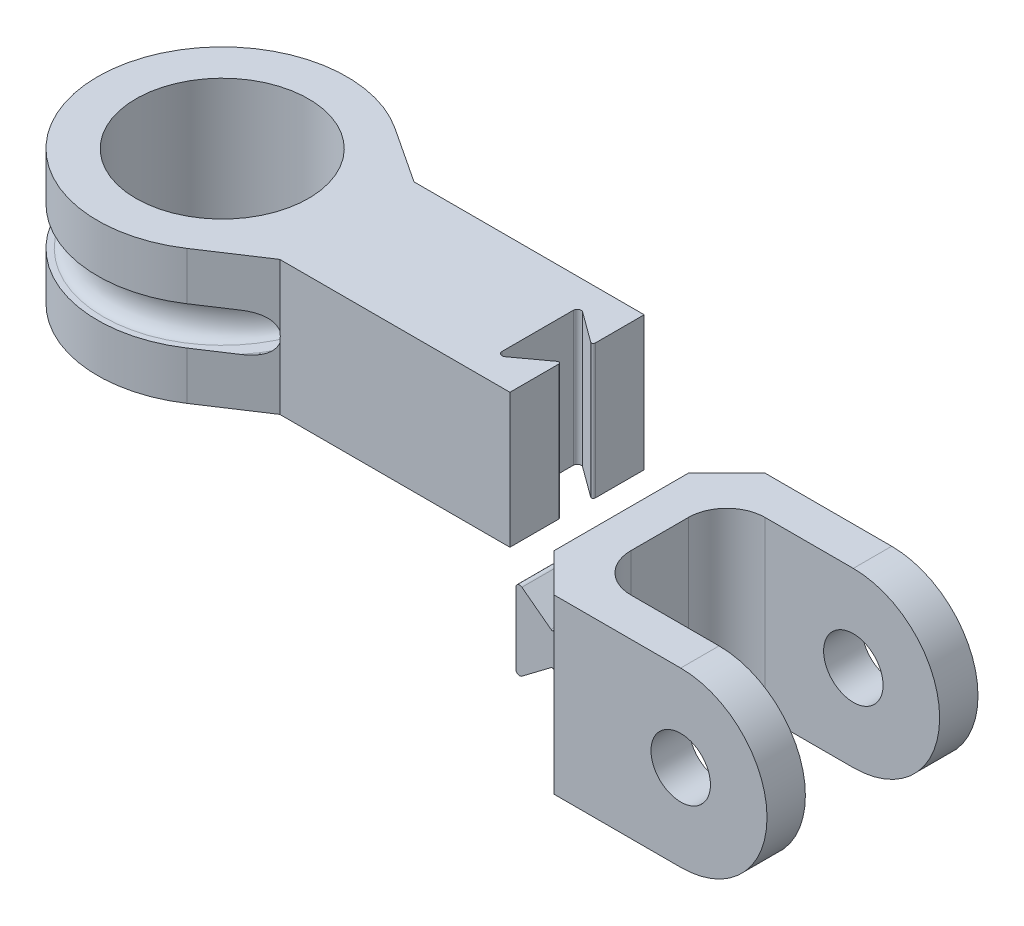
from build123d import *

# Parameters (mm, degrees)
SKETCH2_R            = 4.5
BOSS_EXTRUDE3_DEPTH  = 7
BOSS_EXTRUDE4_DEPTH  = 7
BOSS_EXTRUDE10_DEPTH = 2
CUT_EXTRUDE6_DEPTH   = 29.118300343
FILLET4_R            = 2
SKETCH18_R           = 1.55
CUT_EXTRUDE7_DEPTH   = 2
FILLET6_R            = 2


with BuildPart() as part:
    # Sketch2 → Boss-Extrude3 (new body)
    with BuildSketch(Plane(origin=(0, 0, 0), x_dir=(1, 0, 0), z_dir=(0, 1, 0))):
        with BuildLine():
            Line((6.168188074, -3.5), (6.168188074, -0.952081813))
            ThreePointArc((6.168188074, -0.952081813), (6.113436832, -0.862904742), (6.009137075, -0.87137878))
            Line((6.009137075, -0.87137878), (4.436290073, -2.02224244))
            ThreePointArc((4.436290073, -2.02224244), (4.22769056, -2.039190516), (4.118188074, -1.860836375))
            Line((4.118188074, -1.860836375), (4.118188074, 1.860836375))
            ThreePointArc((4.118188074, 1.860836375), (4.22769056, 2.039190516), (4.436290073, 2.02224244))
            Line((4.436290073, 2.02224244), (6.009137075, 0.87137878))
            ThreePointArc((6.009137075, 0.87137878), (6.113436832, 0.862904742), (6.168188074, 0.952081813))
            Line((6.168188074, 0.952081813), (6.168188074, 3.5))
            Line((6.168188074, 3.5), (-5.831811926, 3.5))
            Line((-5.831811926, 3.5), (-8.753830274, 5.426605505))
            ThreePointArc((-8.753830274, 5.426605505), (-18.831811926, 0), (-8.753830274, -5.426605505))
            Line((-8.753830274, -5.426605505), (-5.831811926, -3.5))
            Line((-5.831811926, -3.5), (6.168188074, -3.5))
        make_face()
        with Locations(Location((-12.331811926, 0, 0), (0, 0, 270))):
            Circle(SKETCH2_R, mode=Mode.SUBTRACT)
    extrude(amount=BOSS_EXTRUDE3_DEPTH)

    # Sketch19 → Cut-Revolve1 (revolve, cut)
    with BuildSketch(Plane(origin=(-12.33, -4.465182267, -12.793633871), x_dir=(0, 1, 0), z_dir=(1, 0, 0))):
        with BuildLine():
            Line((6.965182267, 6.598633871), (6.965182267, 5.988633871))
            add(Edge.make_bspline(
                [(6.965182267, 5.988633871), (6.965182267, 5.388633871), (7.965182267, 5.388633871), (8.965182267, 5.388633871), (8.965182267, 5.988633871)],
                knots=[3.141592654, 3.141592654, 3.141592654, 4.71238898, 4.71238898, 6.283185307, 6.283185307, 6.283185307], degree=2, weights=[1, 0.707106781, 1, 0.707106781, 1]))
            Line((8.965182267, 5.988633871), (8.965182267, 6.598633871))
            add(Edge.make_bspline(
                [(8.965182267, 6.598633871), (8.965182267, 7.198633871), (7.965182267, 7.198633871), (6.965182267, 7.198633871), (6.965182267, 6.598633871)],
                knots=[3.141592654, 3.141592654, 3.141592654, 4.71238898, 4.71238898, 6.283185307, 6.283185307, 6.283185307], degree=2, weights=[1, 0.707106781, 1, 0.707106781, 1]))
        make_face()
    revolve(axis=Axis((-12.33, 7, 0), (0, -1, 0)), mode=Mode.SUBTRACT)


with BuildPart() as body_2:
    # Sketch3 → Boss-Extrude4 (new body)
    with BuildSketch(Plane.XY):
        with BuildLine():
            Line((9.972670663, -1.848398723), (9.972670663, 1.848398723))
            ThreePointArc((9.972670663, 1.848398723), (10.083513588, 2.027426699), (10.293180823, 2.008014829))
            Line((10.293180823, 2.008014829), (11.812415583, 0.860992585))
            ThreePointArc((11.812415583, 0.860992585), (11.9172492, 0.851286651), (11.972670663, 0.940800638))
            Line((11.972670663, 0.940800638), (11.972670663, 4.5))
            Line((11.972670663, 4.5), (13.972670663, 4.5))
            Line((13.972670663, 4.5), (13.972670663, -4.5))
            Line((13.972670663, -4.5), (11.972670663, -4.5))
            Line((11.972670663, -4.5), (11.972670663, -0.940800638))
            ThreePointArc((11.972670663, -0.940800638), (11.9172492, -0.851286651), (11.812415583, -0.860992585))
            Line((11.812415583, -0.860992585), (10.293180823, -2.008014829))
            ThreePointArc((10.293180823, -2.008014829), (10.083513588, -2.027426699), (9.972670663, -1.848398723))
        make_face()
    extrude(amount=BOSS_EXTRUDE4_DEPTH)

    # Sketch15 → Boss-Extrude10 (add)
    with BuildSketch(Plane.XY.offset(7)):
        with BuildLine():
            Line((11.972670663, 4.5), (20.572670663, 4.5))
            ThreePointArc((20.572670663, 4.5), (25.072670663, 0), (20.572670663, -4.5))
            Line((20.572670663, -4.5), (11.972670663, -4.5))
            Line((11.972670663, -4.5), (11.972670663, 4.5))
        make_face()
    boss_extrude10 = extrude(amount=BOSS_EXTRUDE10_DEPTH)

    # Sketch16 → Cut-Extrude6 (cut, through all)
    with BuildSketch(Plane(origin=(0, 4.5, 0), x_dir=(1, 0, 0), z_dir=(0, 1, 0))):
        Polygon((11.972670663, -7), (13.972670663, -9), (11.972670663, -9), align=None)
    cut_extrude6 = extrude(amount=-CUT_EXTRUDE6_DEPTH, mode=Mode.SUBTRACT)

    # Fillet4
    fillet4_edges = [body_2.edges().sort_by_distance(p)[0] for p in [
        (13.972670663, 0, 7),
    ]]
    fillet(fillet4_edges, radius=FILLET4_R)

    # Sketch18 → Cut-Extrude7 (cut)
    with BuildSketch(Plane.XY.offset(9)):
        with Locations((20.572670663, 0)):
            Circle(SKETCH18_R)
    cut_extrude7 = extrude(amount=-CUT_EXTRUDE7_DEPTH, mode=Mode.SUBTRACT)

    # Mirror7: Boss-Extrude10, Cut-Extrude6, Cut-Extrude7 across plane
    add(boss_extrude10.mirror(Plane.XY.offset(3.5)))
    add(cut_extrude6.mirror(Plane.XY.offset(3.5)), mode=Mode.SUBTRACT)
    add(cut_extrude7.mirror(Plane.XY.offset(3.5)), mode=Mode.SUBTRACT)

    # Fillet6
    fillet6_edges = [body_2.edges().sort_by_distance(p)[0] for p in [
        (13.972670663, 0, 0),
    ]]
    fillet(fillet6_edges, radius=FILLET6_R)


solid = Compound([part.part, body_2.part])
